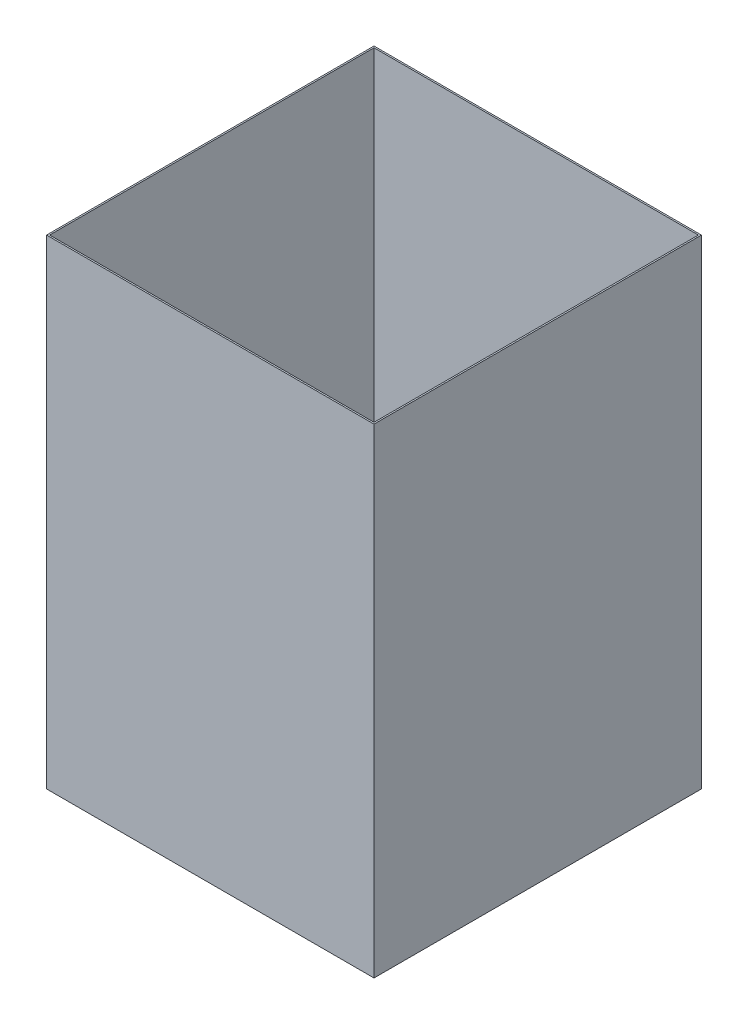
from build123d import *

# Parameters (mm, degrees)
SKETCH1_W           = 430
SKETCH1_H           = 430
BOSS_EXTRUDE1_DEPTH = 630
SHELL1_T            = -2


with BuildPart() as part:
    # Sketch1 → Boss-Extrude1 (new body)
    with BuildSketch(Plane(origin=(0, 0, 0), x_dir=(1, 0, 0), z_dir=(0, 1, 0))):
        Rectangle(SKETCH1_W, SKETCH1_H)
    extrude(amount=BOSS_EXTRUDE1_DEPTH)

    # Shell1
    shell1_openings = [part.faces().sort_by_distance(p)[0] for p in [
        (0, 630, 0),
    ]]
    offset(amount=SHELL1_T, openings=shell1_openings, kind=Kind.INTERSECTION)


solid = part.part
